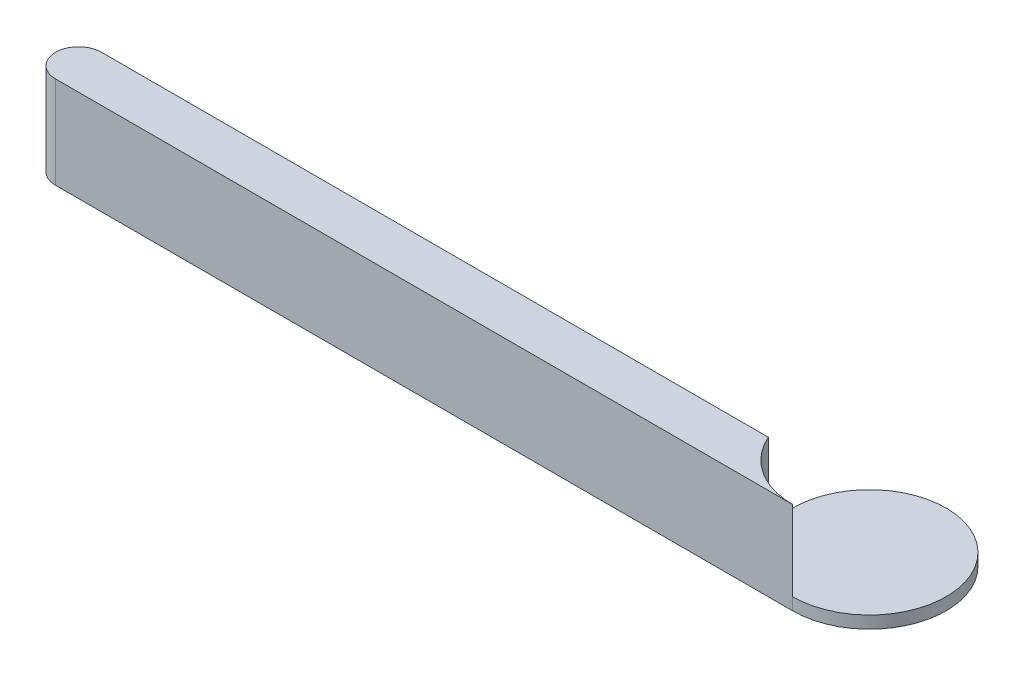
from build123d import *

# Parameters (mm, degrees)
BOSS_EXTRUDE1_DEPTH = 19.05
CUT_EXTRUDE1_START  = -16.51
SKETCH2_R           = 15.875
CUT_EXTRUDE1_DEPTH  = 16.51


with BuildPart() as part:
    # Sketch1 → Boss-Extrude1 (new body)
    with BuildSketch(Plane(origin=(0, 0, 0), x_dir=(1, 0, 0), z_dir=(0, 1, 0))):
        with BuildLine():
            Line((0, -4.7625), (152.4, -4.7625))
            ThreePointArc((152.4, -4.7625), (161.0950956, 24.394477921), (137.850322169, 4.7625))
            Line((137.850322169, 4.7625), (0, 4.7625))
            ThreePointArc((0, 4.7625), (-4.7625, 0), (0, -4.7625))
        make_face()
    extrude(amount=BOSS_EXTRUDE1_DEPTH)

    # Sketch2 → Cut-Extrude1 (cut)
    with BuildSketch(Plane(origin=(0, 19.05, 0), x_dir=(1, 0, 0), z_dir=(0, 1, 0)).offset(CUT_EXTRUDE1_START)):
        with Locations((152.4, 11.1125)):
            Circle(SKETCH2_R)
    extrude(amount=CUT_EXTRUDE1_DEPTH, mode=Mode.SUBTRACT)


solid = part.part
